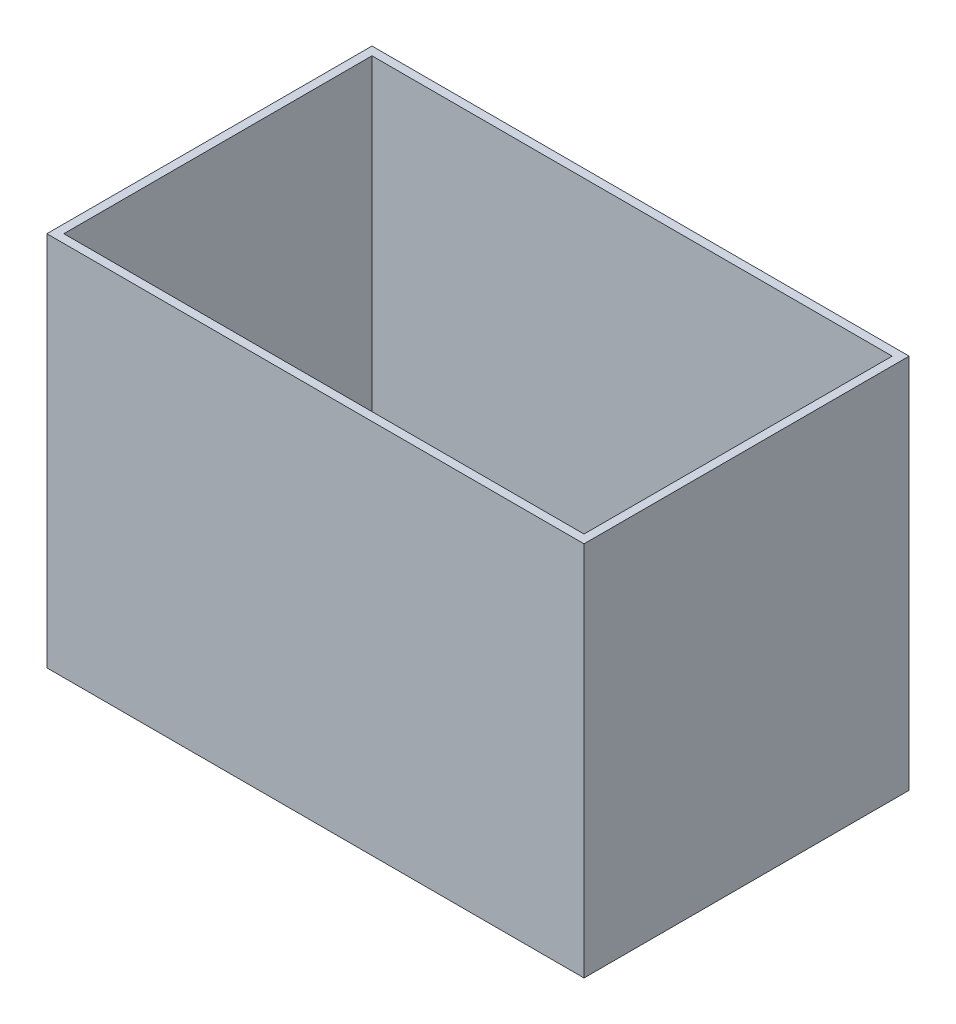
from build123d import *

# Parameters (mm, degrees)
SKETCH1_W           = 380
SKETCH1_H           = 230
BOSS_EXTRUDE1_DEPTH = 6
SKETCH2_W           = 380
SKETCH2_H           = 230
SKETCH2_W_2         = 368
SKETCH2_H_2         = 218
BOSS_EXTRUDE2_DEPTH = 260


with BuildPart() as part:
    # Sketch1 → Boss-Extrude1 (new body)
    with BuildSketch(Plane(origin=(0, 0, 0), x_dir=(1, 0, 0), z_dir=(0, 1, 0))):
        with Locations((190, -115)):
            Rectangle(SKETCH1_W, SKETCH1_H)
    extrude(amount=BOSS_EXTRUDE1_DEPTH)

    # Sketch2 → Boss-Extrude2 (add)
    with BuildSketch(Plane(origin=(0, 6, 0), x_dir=(1, 0, 0), z_dir=(0, 1, 0))):
        with Locations((190, -115)):
            Rectangle(SKETCH2_W, SKETCH2_H)
        with Locations((190, -115)):
            Rectangle(SKETCH2_W_2, SKETCH2_H_2, mode=Mode.SUBTRACT)
    extrude(amount=BOSS_EXTRUDE2_DEPTH)


solid = part.part
